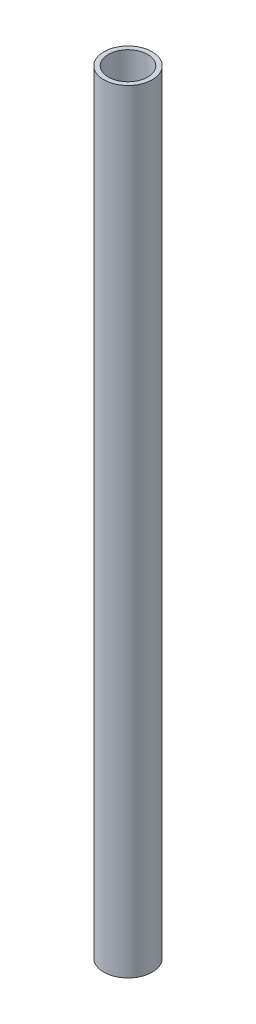
from build123d import *

# Parameters (mm, degrees)
SKETCH_1_R      = 10.65
SKETCH_1_R_2    = 8.65
EXTRUDE_1_DEPTH = 340


with BuildPart() as part:
    # Эскиз1 → Бобышка-Вытянуть1 (new body)
    with BuildSketch(Plane(origin=(0, 0, 0), x_dir=(1, 0, 0), z_dir=(0, 1, 0))):
        with Locations(Location((0, -1.5, 0), (0, 0, 90))):
            Circle(SKETCH_1_R)
        with Locations(Location((0, -1.5, 0), (0, 0, 90))):
            Circle(SKETCH_1_R_2, mode=Mode.SUBTRACT)
    extrude(amount=EXTRUDE_1_DEPTH)


solid = part.part
